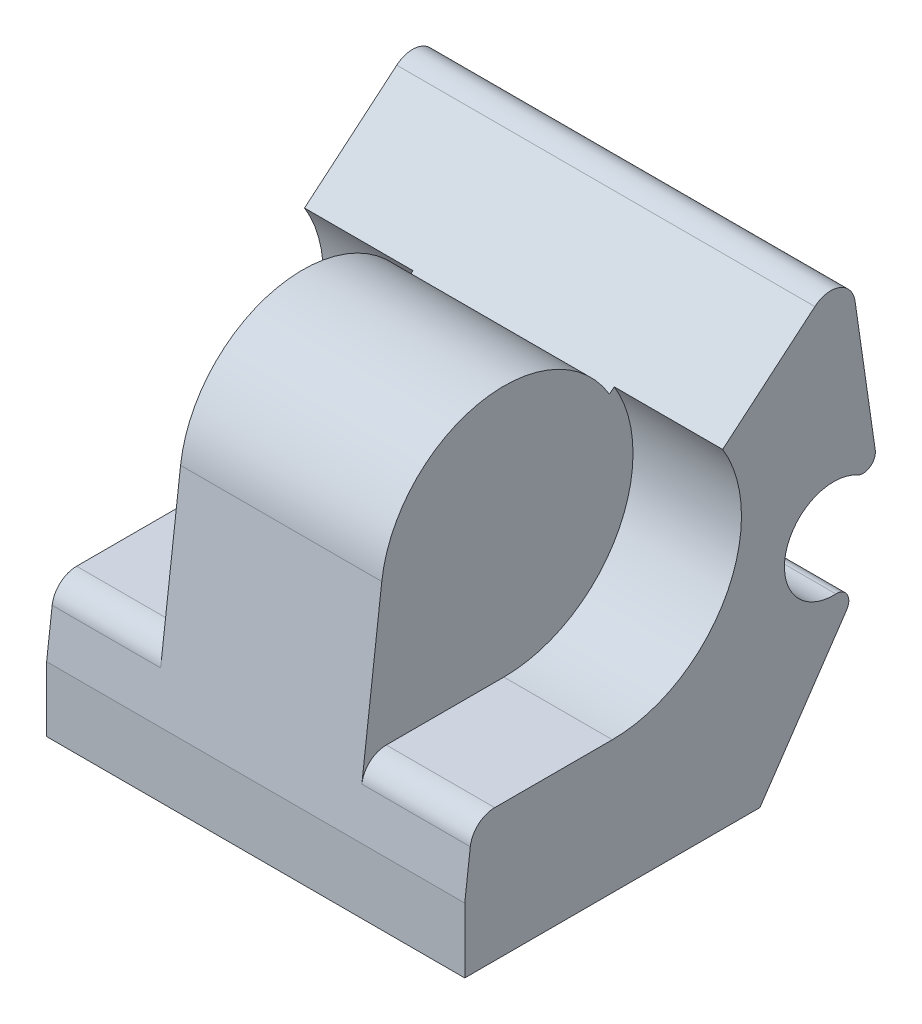
from build123d import *

# Parameters (mm, degrees)
BOSS_EXTRUDE1_DEPTH = 26.9875
SKETCH2_R           = 3.175
BOSS_EXTRUDE2_DEPTH = 26.9875
CUT_EXTRUDE1_DEPTH  = 14
CUT_EXTRUDE2_START  = -39.975
CUT_EXTRUDE2_DEPTH  = 14
CUT_EXTRUDE3_DEPTH  = 17.6276
CUT_EXTRUDE4_START  = -53.975
CUT_EXTRUDE4_DEPTH  = 17.6276


with BuildPart() as part:
    # Sketch1 → Boss-Extrude1 (new, symmetric)
    with BuildSketch(Plane(origin=(0, 0, 0), x_dir=(0, 0, -1), z_dir=(1, 0, 0))):
        with BuildLine():
            Line((-15.761022628, 1.898891971), (-19.05, -25.4))
            Line((-19.05, -25.4), (-19.05, -33.782))
            Line((-19.05, -33.782), (19.05, -33.782))
            Line((19.05, -33.782), (19.05, -25.4))
            Line((19.05, -25.4), (15.761022628, 1.898891971))
            ThreePointArc((15.761022628, 1.898891971), (0, 15.875), (-15.761022628, 1.898891971))
        make_face()
    extrude(amount=BOSS_EXTRUDE1_DEPTH, both=True)

    # Sketch2 → Boss-Extrude2 (add, symmetric)
    with BuildSketch(Plane(origin=(0, 0, 0), x_dir=(0, 0, -1), z_dir=(1, 0, 0))):
        with BuildLine():
            Line((34.849752976, -7.546656143), (31.331707433, 16.706942484))
            ThreePointArc((31.331707433, 16.706942484), (29.318806596, 19.218576271), (26.145386515, 18.680543695))
            Line((26.145386515, 18.680543695), (13.625741227, 8.145845629))
            ThreePointArc((13.625741227, 8.145845629), (15.021703631, 5.134592976), (15.761022628, 1.898891971))
            Line((15.761022628, 1.898891971), (19.05, -25.4))
            Line((19.05, -25.4), (19.05, -33.782))
            Line((19.05, -33.782), (33.819378976, -12.024635583))
            ThreePointArc((33.819378976, -12.024635583), (34.753812672, -9.882113678), (34.849752976, -7.546656143))
        make_face()
        with Locations((28.565519705, -8.4582)):
            Circle(SKETCH2_R, mode=Mode.SUBTRACT)
    extrude(amount=BOSS_EXTRUDE2_DEPTH, both=True)

    # Sketch3 → Cut-Extrude1 (cut)
    with BuildSketch(Plane(origin=(26.9875, 0, 0), x_dir=(0, 0, -1), z_dir=(1, 0, 0))):
        with BuildLine():
            Line((-15.18262128, -16.66875), (0, -16.66875))
            ThreePointArc((0, -16.66875), (14.530186835, -8.168286057), (14.240626625, 8.663243036))
            Line((14.240626625, 8.663243036), (13.625741227, 8.145845629))
            ThreePointArc((13.625741227, 8.145845629), (-3.300903538, 15.528028234), (-15.761022628, 1.898891971))
            Line((-15.761022628, 1.898891971), (-18.334825806, -19.463971606))
            ThreePointArc((-18.334825806, -19.463971606), (-17.289138382, -17.468205704), (-15.18262128, -16.66875))
        make_face()
    extrude(amount=-CUT_EXTRUDE1_DEPTH, mode=Mode.SUBTRACT)

    # Sketch3<3> → Cut-Extrude2 (cut)
    with BuildSketch(Plane(origin=(26.9875, 0, 0), x_dir=(0, 0, -1), z_dir=(1, 0, 0)).offset(CUT_EXTRUDE2_START)):
        with BuildLine():
            Line((-15.18262128, -16.66875), (0, -16.66875))
            ThreePointArc((0, -16.66875), (14.530186835, -8.168286057), (14.240626625, 8.663243036))
            Line((14.240626625, 8.663243036), (13.625741227, 8.145845629))
            ThreePointArc((13.625741227, 8.145845629), (-3.300903538, 15.528028234), (-15.761022628, 1.898891971))
            Line((-15.761022628, 1.898891971), (-18.334825806, -19.463971606))
            ThreePointArc((-18.334825806, -19.463971606), (-17.289138382, -17.468205704), (-15.18262128, -16.66875))
        make_face()
    extrude(amount=-CUT_EXTRUDE2_DEPTH, mode=Mode.SUBTRACT)

    # Sketch4 → Cut-Extrude3 (cut)
    with BuildSketch(Plane(origin=(26.9875, 0, 0), x_dir=(0, 0, -1), z_dir=(1, 0, 0))):
        with BuildLine():
            Line((33.819378976, -12.024635583), (30.252943393, -17.278494853))
            ThreePointArc((30.252943393, -17.278494853), (30.324357139, -15.61082693), (28.864686801, -14.801148766))
            ThreePointArc((28.864686801, -14.801148766), (22.377226739, -7.034286322), (31.606824582, -2.883887069))
            ThreePointArc((31.606824582, -2.883887069), (33.273576843, -2.793592413), (33.938209118, -1.262422872))
            Line((33.938209118, -1.262422872), (34.849752976, -7.546656143))
            ThreePointArc((34.849752976, -7.546656143), (34.753812672, -9.882113678), (33.819378976, -12.024635583))
        make_face()
    extrude(amount=-CUT_EXTRUDE3_DEPTH, mode=Mode.SUBTRACT)

    # Sketch5<3> → Cut-Extrude4 (cut)
    with BuildSketch(Plane(origin=(26.9875, 0, 0), x_dir=(0, 0, -1), z_dir=(1, 0, 0)).offset(CUT_EXTRUDE4_START)):
        with BuildLine():
            Line((33.819378976, -12.024635583), (30.252943393, -17.278494853))
            ThreePointArc((30.252943393, -17.278494853), (30.324357139, -15.61082693), (28.864686801, -14.801148766))
            ThreePointArc((28.864686801, -14.801148766), (22.377226739, -7.034286322), (31.606824582, -2.883887069))
            ThreePointArc((31.606824582, -2.883887069), (33.273576843, -2.793592413), (33.938209118, -1.262422872))
            Line((33.938209118, -1.262422872), (34.849752976, -7.546656143))
            ThreePointArc((34.849752976, -7.546656143), (34.753812672, -9.882113678), (33.819378976, -12.024635583))
        make_face()
    extrude(amount=CUT_EXTRUDE4_DEPTH, mode=Mode.SUBTRACT)


solid = part.part
